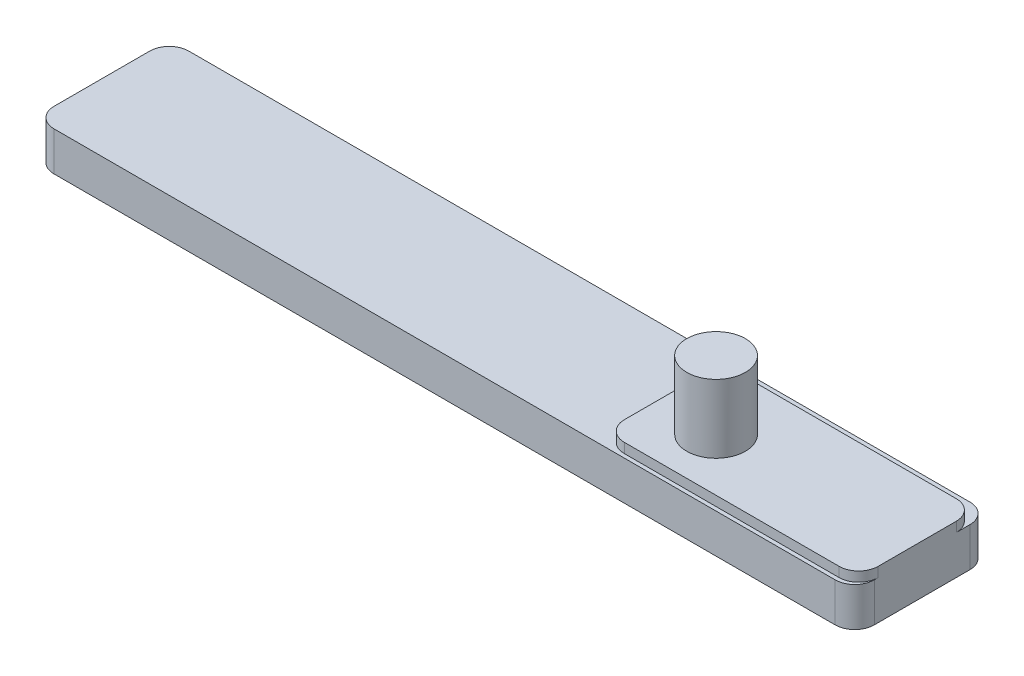
from build123d import *

# Parameters (mm, degrees)
SKETCH_1_W          = 42
SKETCH_1_H          = 7.4
EXTRUDE_1_DEPTH     = 2.5
SKETCH_2_R          = 1.5
EXTRUDE_2_DEPTH     = 3.5
SKETCH_3_W          = 29
SKETCH_3_H          = 7.4
CUT_EXTRUDE_1_DEPTH = 0.5
SKETCH_4_W          = 13
SKETCH_4_H          = 0.7
CUT_EXTRUDE_2_DEPTH = 0.5
CUT_EXTRUDE_3_REACH = 44.834
SKETCH_5_W          = 42
SKETCH_5_H          = 0.5
FILLET_1_R          = 1
FILLET_2_R          = 1


with BuildPart() as part:
    # 草图1 → 凸台-拉伸1 (new body)
    with BuildSketch(Plane(origin=(0, 0, 0), x_dir=(1, 0, 0), z_dir=(0, 1, 0))):
        with Locations((21, 3.7)):
            Rectangle(SKETCH_1_W, SKETCH_1_H)
    extrude(amount=EXTRUDE_1_DEPTH)

    # 草图2 → 凸台-拉伸2 (add)
    with BuildSketch(Plane(origin=(0, 2.5, 0), x_dir=(1, 0, 0), z_dir=(0, 1, 0))):
        with Locations(Location((32, 3.4, 0), (0, 0, 90))):
            Circle(SKETCH_2_R)
    extrude(amount=EXTRUDE_2_DEPTH)

    # 草图3 → 切除-拉伸1 (cut)
    with BuildSketch(Plane(origin=(0, 2.5, 0), x_dir=(1, 0, 0), z_dir=(0, 1, 0))):
        with Locations((14.5, 3.7)):
            Rectangle(SKETCH_3_W, SKETCH_3_H)
    extrude(amount=-CUT_EXTRUDE_1_DEPTH, mode=Mode.SUBTRACT)

    # 草图4 → 切除-拉伸2 (cut)
    with BuildSketch(Plane(origin=(0, 2.5, 0), x_dir=(1, 0, 0), z_dir=(0, 1, 0))):
        with Locations((35.5, 7.05)):
            Rectangle(SKETCH_4_W, SKETCH_4_H)
        with Locations((35.5, 0.35)):
            Rectangle(SKETCH_4_W, SKETCH_4_H)
    extrude(amount=-CUT_EXTRUDE_2_DEPTH, mode=Mode.SUBTRACT)

    # 草图5 → 切除-拉伸3 (cut, up to next)
    with BuildSketch(Plane(origin=(0, 2, 0), x_dir=(1, 0, 0), z_dir=(0, 1, 0)), mode=Mode.PRIVATE) as cut_extrude_3_sk1:
        with Locations((21, 0.25)):
            Rectangle(SKETCH_5_W, SKETCH_5_H)
    cut_extrude_3_tool1 = extrude(cut_extrude_3_sk1.sketch, amount=-CUT_EXTRUDE_3_REACH, mode=Mode.PRIVATE) & part.part
    add(cut_extrude_3_tool1.solids().sort_by_distance((21, 2, -0.25))[0], mode=Mode.SUBTRACT)

    # 圆角1
    fillet_1_edges = [part.edges().sort_by_distance(p)[0] for p in [
        (0, 1, -7.4),
        (29, 2.25, -6.7),
        (42, 2.25, -6.7),
        (29, 2.25, -0.7),
        (42, 2.25, -0.7),
        (0, 1, -0.5),
    ]]
    fillet(fillet_1_edges, radius=FILLET_1_R)

    # 圆角2
    fillet_2_edges = [part.edges().sort_by_distance(p)[0] for p in [
        (42, 1, -7.4),
        (42, 1, -0.5),
    ]]
    fillet(fillet_2_edges, radius=FILLET_2_R)


solid = part.part
